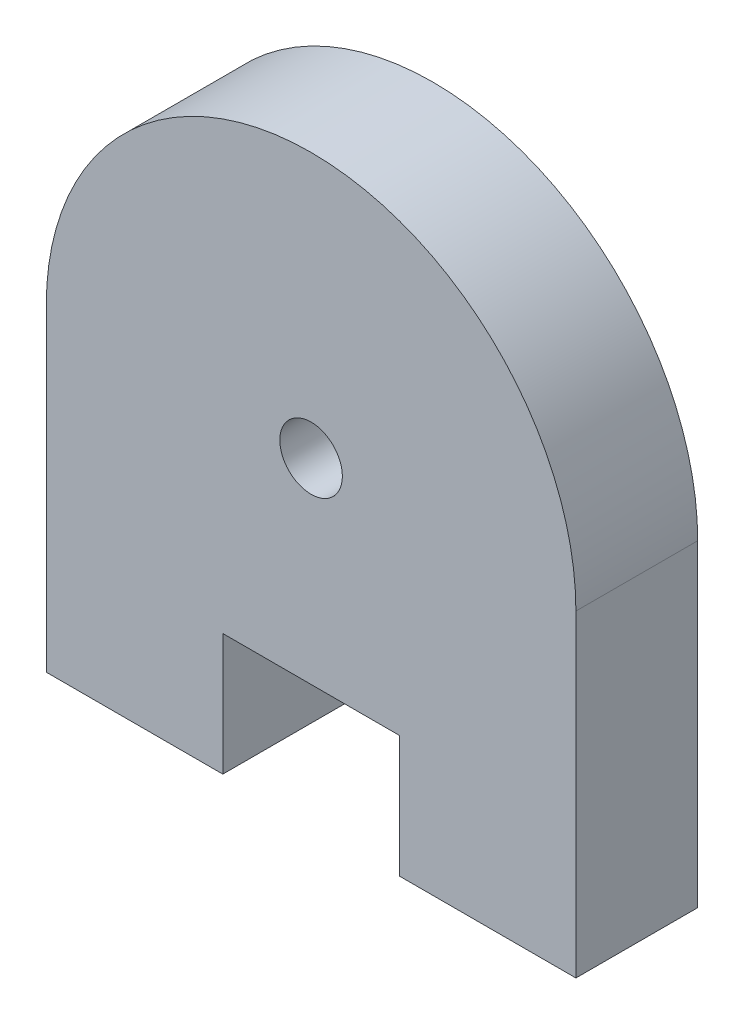
from build123d import *

# Parameters (mm, degrees)
SKETCH1_R           = 1.5
BOSS_EXTRUDE1_DEPTH = 5.842
SKETCH3_W           = 8.466666667
SKETCH3_H           = 5.842
CUT_EXTRUDE2_DEPTH  = 5.842


with BuildPart() as part:
    # Sketch1 → Boss-Extrude1 (new body)
    with BuildSketch(Plane.XY):
        with BuildLine():
            Line((10.22047619, -9.525), (-15.17952381, -9.525))
            Line((-15.17952381, -9.525), (-15.17952381, 5.715))
            ThreePointArc((-15.17952381, 5.715), (-2.47952381, 18.415), (10.22047619, 5.715))
            Line((10.22047619, 5.715), (10.22047619, -9.525))
        make_face()
        with Locations((-2.47952381, 5.715)):
            Circle(SKETCH1_R, mode=Mode.SUBTRACT)
    extrude(amount=BOSS_EXTRUDE1_DEPTH)

    # Sketch3 → Cut-Extrude2 (cut)
    with BuildSketch(Plane.XY.offset(5.842)):
        with Locations((-2.47952381, -6.604)):
            Rectangle(SKETCH3_W, SKETCH3_H)
    extrude(amount=-CUT_EXTRUDE2_DEPTH, mode=Mode.SUBTRACT)


solid = part.part
